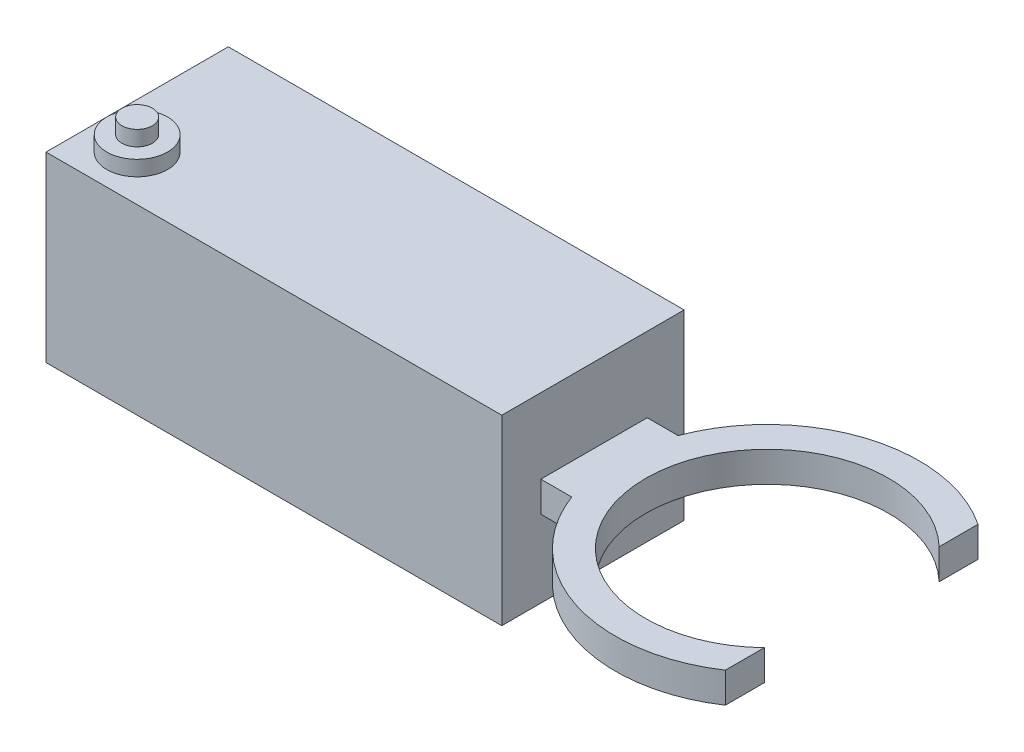
from build123d import *

# Parameters (mm, degrees)
SKETCH1_W           = 150
SKETCH1_H           = 60
BOSS_EXTRUDE2_DEPTH = 60
SKETCH3_R           = 10
BOSS_EXTRUDE3_DEPTH = 5
SKETCH4_R           = 5
BOSS_EXTRUDE4_DEPTH = 5
SKETCH5_W           = 35
SKETCH5_H           = 10
BOSS_EXTRUDE5_DEPTH = 15
BOSS_EXTRUDE7_DEPTH = 10


with BuildPart() as part:
    # Sketch1 → Boss-Extrude2 (new body)
    with BuildSketch(Plane.XY):
        Rectangle(SKETCH1_W, SKETCH1_H)
    extrude(amount=-BOSS_EXTRUDE2_DEPTH)

    # Sketch3 → Boss-Extrude3 (add)
    with BuildSketch(Plane(origin=(0, 30, 0), x_dir=(1, 0, 0), z_dir=(0, 1, 0))):
        with Locations(Location((-60, 15, 0), (0, 0, 270))):
            Circle(SKETCH3_R)
    extrude(amount=BOSS_EXTRUDE3_DEPTH)

    # Sketch4 → Boss-Extrude4 (add)
    with BuildSketch(Plane(origin=(0, 35, 0), x_dir=(1, 0, 0), z_dir=(0, 1, 0))):
        with Locations(Location((-60, 15, 0), (0, 0, 270))):
            Circle(SKETCH4_R)
    extrude(amount=BOSS_EXTRUDE4_DEPTH)

    # Sketch5 → Boss-Extrude5 (add)
    with BuildSketch(Plane(origin=(75, 0, 0), x_dir=(0, 0, -1), z_dir=(1, 0, 0))):
        with Locations((30.361935687, 0.340382959)):
            Rectangle(SKETCH5_W, SKETCH5_H)
    extrude(amount=BOSS_EXTRUDE5_DEPTH)

    # Sketch6 → Boss-Extrude7 (add)
    with BuildSketch(Plane(origin=(0, 5.340382959, 0), x_dir=(1, 0, 0), z_dir=(0, 1, 0))):
        with BuildLine():
            Line((159.790141343, 1.592020078), (159.790141343, -11.203771863))
            ThreePointArc((159.790141343, -11.203771863), (82, 30.361935687), (159.790141343, 71.927643238))
            Line((159.790141343, 71.927643238), (159.790141343, 59.131851296))
            ThreePointArc((159.790141343, 59.131851296), (92, 30.361935687), (159.790141343, 1.592020078))
        make_face()
    extrude(amount=-BOSS_EXTRUDE7_DEPTH)


solid = part.part
